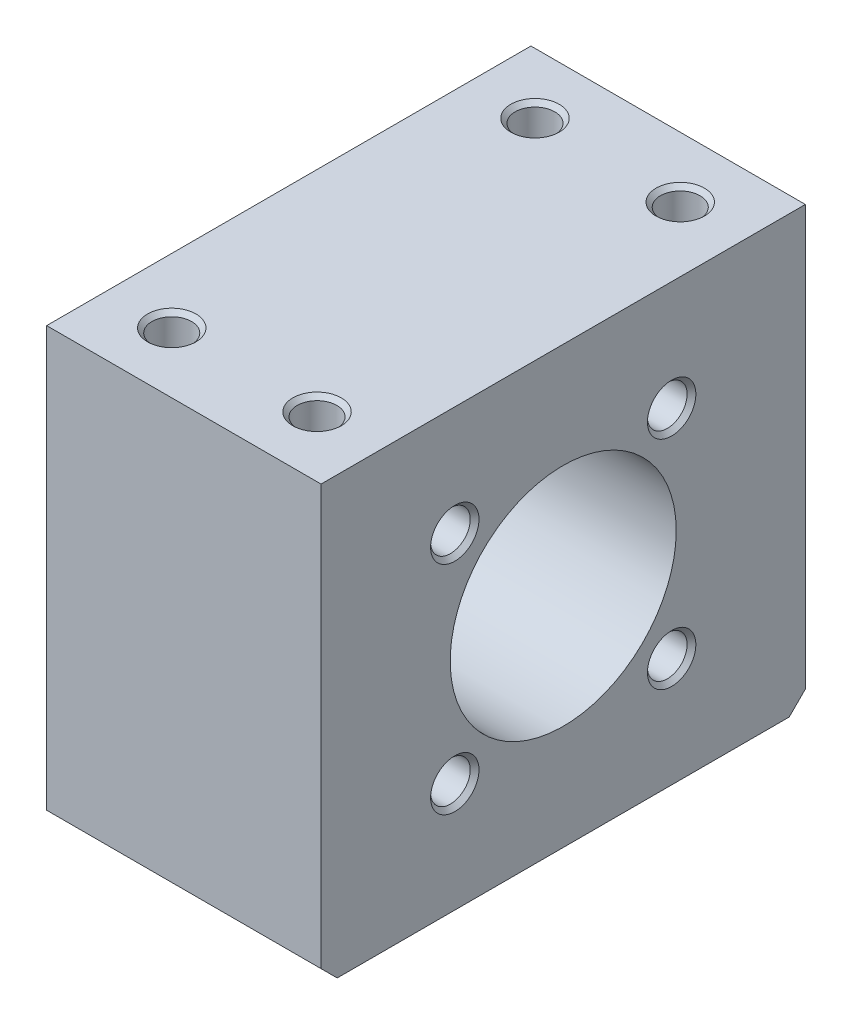
from build123d import *

# Parameters (mm, degrees)
SCHIZZO1_W                   = 60
SCHIZZO1_H                   = 54
ESTRUSIONE_ESTRUSIONE1_DEPTH = 34
FORO_PER_VITE_M24_1_D        = 28
FORO1_D                      = 4.917
FORO1_DEPTH                  = 14.312635171
FORO1_TIP                    = 1.419415637
FORO2_D                      = 4.917
FORO2_DEPTH                  = 12.312635171
FORO2_TIP                    = 1.419415637
SMUSSO1_SIZE                 = 0.5415
SMUSSO2_SIZE                 = 2


with BuildPart() as part:
    # Schizzo1 → Estrusione-Estrusione1 (new body)
    with BuildSketch(Plane(origin=(17, 0, 0), x_dir=(0, 0, -1), z_dir=(1, 0, 0))):
        Rectangle(SCHIZZO1_W, SCHIZZO1_H)
    extrude(amount=-ESTRUSIONE_ESTRUSIONE1_DEPTH)

    # Foro per Vite M24-1 (through all)
    with Locations(Plane(origin=(17, 0, 0), x_dir=(0, 0, -1), z_dir=(1, 0, 0))):
        with Locations((0, 0)):
            Hole(FORO_PER_VITE_M24_1_D / 2)

    # Foro1
    with Locations(Plane(origin=(0, 27, 0), x_dir=(1, 0, 0), z_dir=(0, 1, 0))):
        with Locations((9, 22.5), (9, -22.5), (-9, 22.5), (-9, -22.5)):
            Hole(FORO1_D / 2, depth=FORO1_DEPTH)
            with Locations((0, 0, -(FORO1_DEPTH + FORO1_TIP / 2))):  # 120° drill point
                Cone(0, FORO1_D / 2, FORO1_TIP, mode=Mode.SUBTRACT)

    # Foro2
    with Locations(Plane(origin=(17, 0, 0), x_dir=(0, 0, -1), z_dir=(1, 0, 0))):
        with Locations((13.435028843, 13.435028843), (-13.435028843, -13.435028843), (13.435028843, -13.435028843), (-13.435028843, 13.435028843)):
            Hole(FORO2_D / 2, depth=FORO2_DEPTH)
            with Locations((0, 0, -(FORO2_DEPTH + FORO2_TIP / 2))):  # 120° drill point
                Cone(0, FORO2_D / 2, FORO2_TIP, mode=Mode.SUBTRACT)

    # Smusso1
    smusso1_edges = [part.edges().sort_by_distance(p)[0] for p in [
        (-6.5415, 27, 22.5),
        (-6.5415, 27, -22.5),
        (11.4585, 27, 22.5),
        (11.4585, 27, -22.5),
        (17, 13.435028843, 10.976528843),
        (17, -13.435028843, -15.893528843),
        (17, -13.435028843, 10.976528843),
        (17, 13.435028843, -15.893528843),
    ]]
    chamfer(smusso1_edges, length=SMUSSO1_SIZE)

    # Smusso2
    smusso2_edges = [part.edges().sort_by_distance(p)[0] for p in [
        (0, -27, 30),
        (0, -27, -30),
    ]]
    chamfer(smusso2_edges, length=SMUSSO2_SIZE)


solid = part.part
